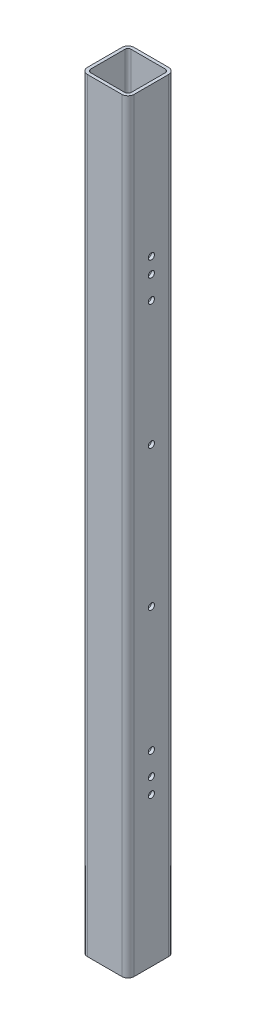
from build123d import *

# Parameters (mm, degrees)
EXTRUDE_1_DEPTH          = 245
CUT_EXTRUDE_2_DEPTH      = 249.646335183
CUT_EXTRUDE_2_DEPTH_BACK = 249.646335183
SKETCH_3_R               = 2


with BuildPart() as part:
    # 草图1 → 凸台-拉伸1 (new, symmetric)
    with BuildSketch(Plane(origin=(0, 0, 0), x_dir=(1, 0, 0), z_dir=(0, 1, 0))):
        with BuildLine():
            Line((4, 0), (26, 0))
            ThreePointArc((26, 0), (28.828427125, 1.171572875), (30, 4))
            Line((30, 4), (30, 26))
            ThreePointArc((30, 26), (28.828427125, 28.828427125), (26, 30))
            Line((26, 30), (4, 30))
            ThreePointArc((4, 30), (1.171572875, 28.828427125), (0, 26))
            Line((0, 26), (0, 4))
            ThreePointArc((0, 4), (1.171572875, 1.171572875), (4, 0))
        make_face()
        with BuildLine():
            Line((4, 2), (26, 2))
            ThreePointArc((26, 2), (27.414213562, 2.585786438), (28, 4))
            Line((28, 4), (28, 26))
            ThreePointArc((28, 26), (27.414213562, 27.414213562), (26, 28))
            Line((26, 28), (4, 28))
            ThreePointArc((4, 28), (2.585786438, 27.414213562), (2, 26))
            Line((2, 26), (2, 4))
            ThreePointArc((2, 4), (2.585786438, 2.585786438), (4, 2))
        make_face(mode=Mode.SUBTRACT)
    extrude(amount=EXTRUDE_1_DEPTH, both=True)

    # 草图3 → 切除-拉伸2 (cut, two sides: drawn at the far end of the back side and taken through both)
    with BuildSketch(Plane(origin=(0, 0, 0), x_dir=(0, 0, -1), z_dir=(1, 0, 0)).offset(-CUT_EXTRUDE_2_DEPTH_BACK)):
        with Locations(Location((15, -149.5, 0), (0, 0, 180))):
            Circle(SKETCH_3_R)
        with Locations(Location((15, -139.5, 0), (0, 0, 180))):
            Circle(SKETCH_3_R)
        with Locations(Location((15, 139.5, 0), (0, 0, 180))):
            Circle(SKETCH_3_R)
        with Locations(Location((15, 149.5, 0), (0, 0, 180))):
            Circle(SKETCH_3_R)
        with Locations(Location((15, 125, 0), (0, 0, 180))):
            Circle(SKETCH_3_R)
        with Locations(Location((15, 45, 0), (0, 0, 180))):
            Circle(SKETCH_3_R)
        with Locations(Location((15, -45, 0), (0, 0, 180))):
            Circle(SKETCH_3_R)
        with Locations(Location((15, -125, 0), (0, 0, 180))):
            Circle(SKETCH_3_R)
    extrude(amount=CUT_EXTRUDE_2_DEPTH + CUT_EXTRUDE_2_DEPTH_BACK, mode=Mode.SUBTRACT)


solid = part.part
